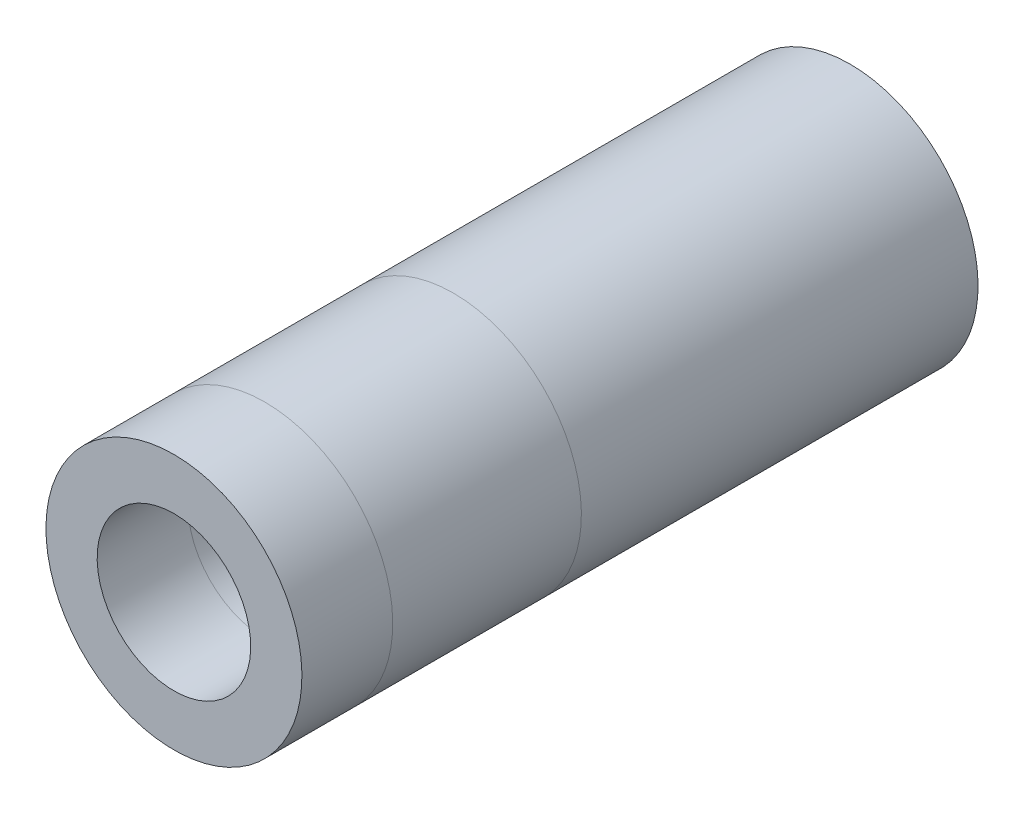
from build123d import *

# Parameters (mm, degrees)
SWEEP1_PROFILE_R     = 7.9375
CUT_SWEEP1_PROFILE_R = 4.7625


with BuildPart() as part:
    # Sweep1: sweep along a curve in space
    with BuildLine() as sweep1_path:
        Line((-46.03, 0, -24.6), (-46.03, 0, 0))
        Line((-46.03, 0, 0), (-46.03, 0, 11.700046958))
        Line((-46.03, 0, 17.333491368), (-46.03, 0, 11.700046958))
    # Sweep1 profile (on start of the path) → Sweep1 (sweep)
    with BuildSketch(Plane(origin=(-46.03, 0, -24.6), x_dir=(1, 0, 0), z_dir=(0, 0, 1))):
        Circle(SWEEP1_PROFILE_R)
    sweep(path=sweep1_path.line)

    # Cut-Sweep1: sweep along a curve in space
    with BuildLine() as cut_sweep1_path:
        Line((-46.03, 0, -24.6), (-46.03, 0, 0))
        Line((-46.03, 0, 0), (-46.03, 0, 11.700046958))
        Line((-46.03, 0, 17.333491368), (-46.03, 0, 11.700046958))
    # Cut-Sweep1 profile (on start of the path) → Cut-Sweep1 (sweep, cut)
    with BuildSketch(Plane(origin=(-46.03, 0, -24.6), x_dir=(1, 0, 0), z_dir=(0, 0, 1))):
        Circle(CUT_SWEEP1_PROFILE_R)
    sweep(path=cut_sweep1_path.line, mode=Mode.SUBTRACT)


solid = part.part
